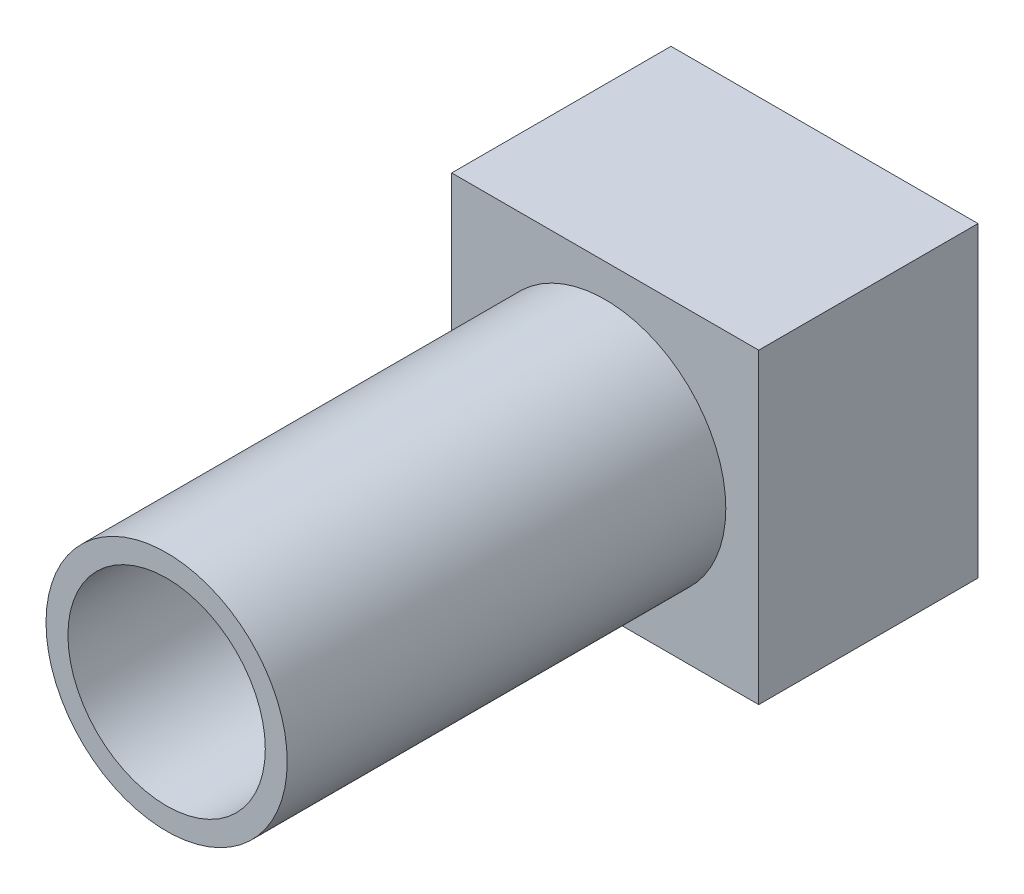
from build123d import *

# Parameters (mm, degrees)
SKETCH_1_W          = 14
SKETCH_1_H          = 14
SKETCH_1_W_2        = 11
SKETCH_1_H_2        = 11
EXTRUDE_1_DEPTH     = 5
SKETCH_2_W          = 14
SKETCH_2_H          = 14
EXTRUDE_2_DEPTH     = 5
SKETCH_3_R          = 5.5
EXTRUDE_3_DEPTH     = 20
SKETCH_4_R          = 4.5
CUT_EXTRUDE_1_DEPTH = 32.591137998


with BuildPart() as part:
    # 草图1 → 凸台-拉伸1 (new body)
    with BuildSketch(Plane.XY):
        Rectangle(SKETCH_1_W, SKETCH_1_H)
        Rectangle(SKETCH_1_W_2, SKETCH_1_H_2, mode=Mode.SUBTRACT)
    extrude(amount=EXTRUDE_1_DEPTH)

    # 草图2 → 凸台-拉伸2 (add)
    with BuildSketch(Plane.XY.offset(5)):
        Rectangle(SKETCH_2_W, SKETCH_2_H)
    extrude(amount=EXTRUDE_2_DEPTH)

    # 草图3 → 凸台-拉伸3 (add)
    with BuildSketch(Plane.XY.offset(10)):
        Circle(SKETCH_3_R)
    extrude(amount=EXTRUDE_3_DEPTH)

    # 草图4 → 切除-拉伸1 (cut, through all)
    with BuildSketch(Plane.XY.offset(30)):
        Circle(SKETCH_4_R)
    extrude(amount=-CUT_EXTRUDE_1_DEPTH, mode=Mode.SUBTRACT)


solid = part.part
